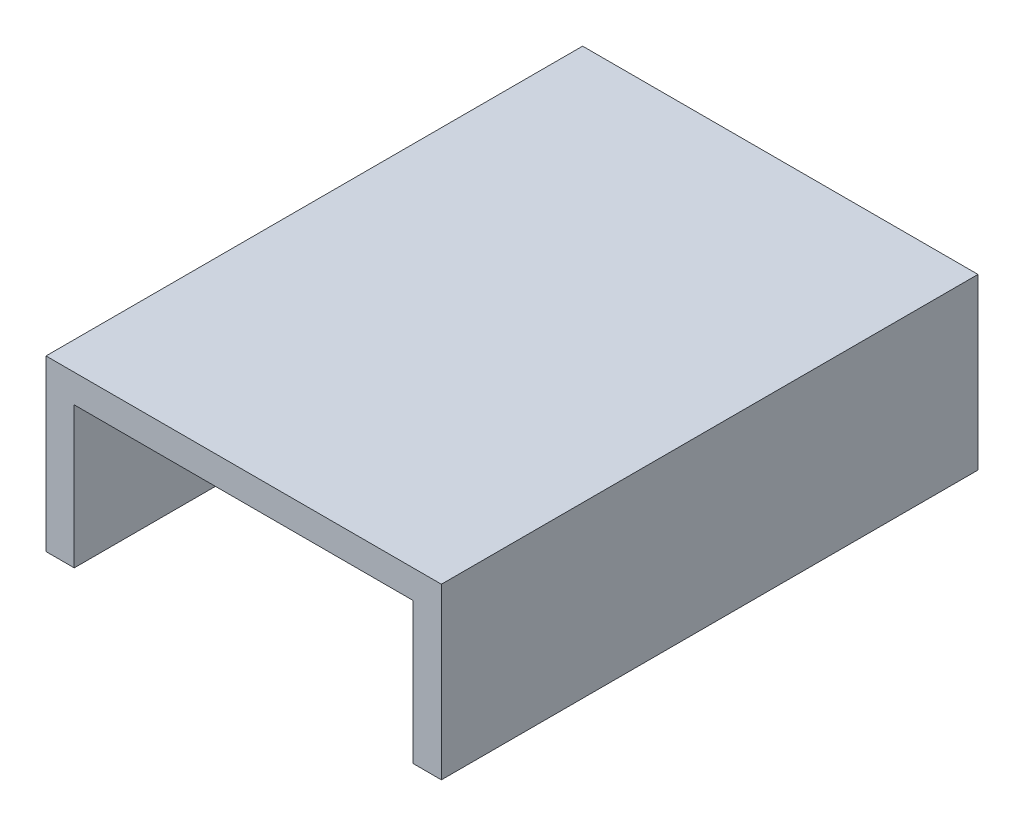
from build123d import *

# Parameters (mm, degrees)
SKETCH1_W           = 70
SKETCH1_H           = 95
BOSS_EXTRUDE1_DEPTH = 30
SKETCH2_W           = 60
SKETCH2_H           = 25
CUT_EXTRUDE1_DEPTH  = 87.5


with BuildPart() as part:
    # Sketch1 → Boss-Extrude1 (new body)
    with BuildSketch(Plane(origin=(0, 0, 0), x_dir=(1, 0, 0), z_dir=(0, 1, 0))):
        Rectangle(SKETCH1_W, SKETCH1_H)
    extrude(amount=BOSS_EXTRUDE1_DEPTH)

    # Sketch2 → Cut-Extrude1 (cut)
    with BuildSketch(Plane.XY.offset(47.5)):
        with Locations((0, 12.5)):
            Rectangle(SKETCH2_W, SKETCH2_H)
    extrude(amount=-CUT_EXTRUDE1_DEPTH, mode=Mode.SUBTRACT)


solid = part.part
